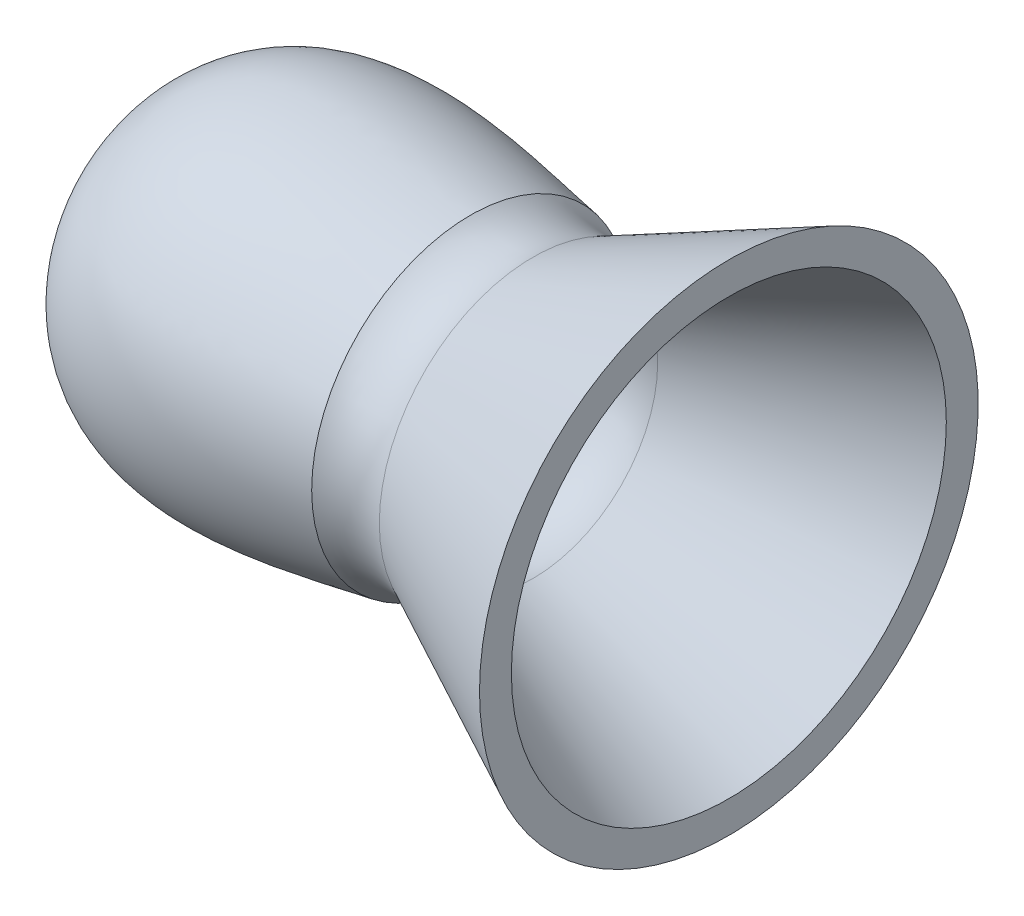
from build123d import *


with BuildPart() as part:
    # Sketch1 → Revolve3 (revolve)
    with BuildSketch(Plane.XY, mode=Mode.PRIVATE) as revolve3_sk:
        with BuildLine():
            Line((129.454909333, 14.91059962), (197.394731405, 48.100475176))
            Line((197.394731405, 48.100475176), (197.394731405, 37.04389981))
            Line((197.394731405, 37.04389981), (129.454909333, 4.864278966))
            ThreePointArc((129.454909333, 4.864278966), (117.469016856, 2.455305087), (106.045092047, 6.809465809))
            add(Edge.make_bspline(
                [(8.134718081, -5.816043478), (8.449281823, -5.376073012), (9.098676561, -4.499357309), (10.411576263, -2.848385412), (12.108741528, -0.928077446), (14.224416257, 1.152393571), (17.155918715, 3.656144733), (21.03332082, 6.318333413), (26.059709975, 8.866214455), (31.481907316, 10.829387399), (39.23334831, 12.72128327), (49.833633799, 13.805122547), (63.584543999, 13.386691556), (75.481021534, 11.987405109), (85.025817049, 10.504842911), (92.146299555, 9.28188719), (98.002645597, 8.230555564), (102.628376471, 7.405096976), (104.902483803, 7.006458439), (106.045092047, 6.809465809)],
                knots=[0, 0, 0, 0, 0.015625, 0.03125, 0.0625, 0.09375, 0.125, 0.1875, 0.25, 0.3125, 0.375, 0.5, 0.625, 0.75, 0.8125, 0.875, 0.9375, 0.96875, 1, 1, 1, 1], degree=3))
            Line((8.134718081, -5.816043478), (0, 0))
            add(Edge.make_bspline(
                [(0, 0), (24.538667418, 34.321466527), (72.006948021, 22.825380489), (107.74408758, 16.664079661)],
                knots=[0, 0, 0, 0, 1, 1, 1, 1], degree=3))
            ThreePointArc((107.74408758, 16.664079661), (118.359206539, 12.812150376), (129.454909333, 14.91059962))
        make_face()
    revolve(revolve3_sk.sketch.rotate(Axis((129.454909333, -38.393563347, 0), (1, 0, 0)), 90), axis=Axis((129.454909333, -38.393563347, 0), (1, 0, 0)))


solid = part.part
